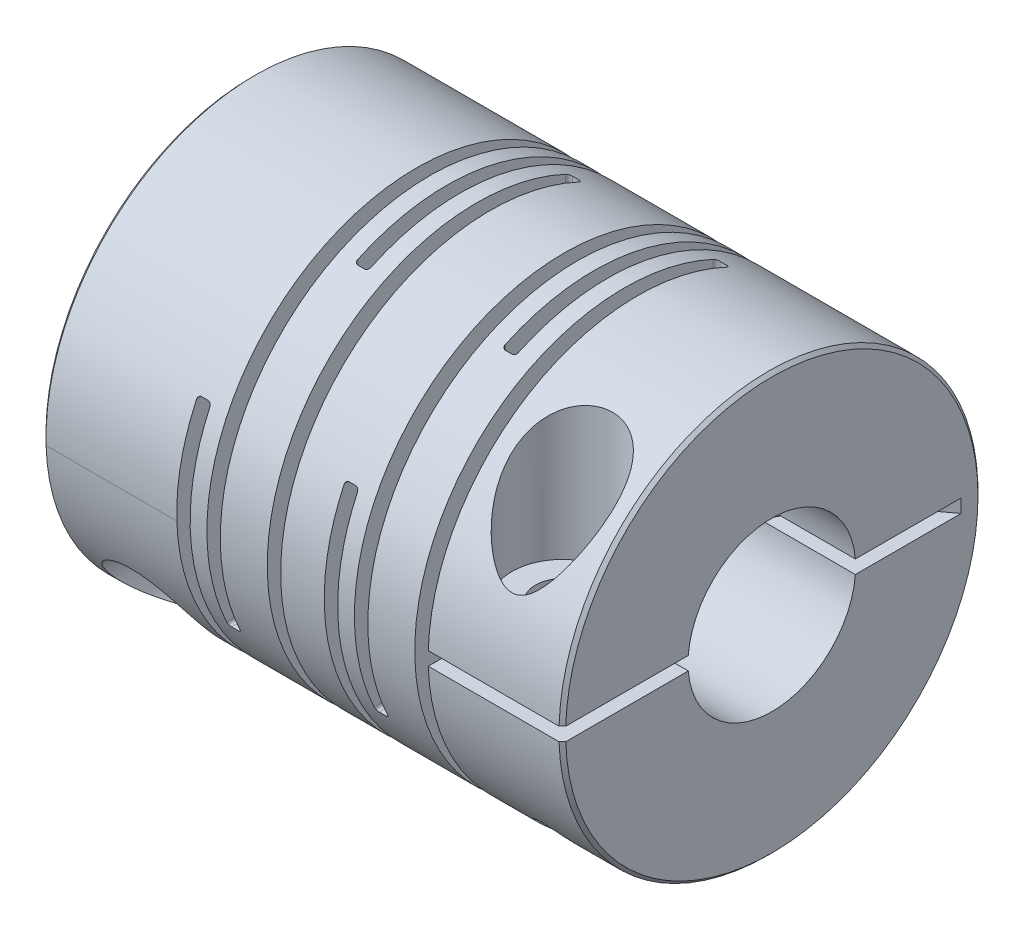
from build123d import *

# Parameters (mm, degrees)
SKETCH1_W                          = 31
SKETCH1_H                          = 12.5
CUT_EXTRUDE1_DEPTH                 = 42.740268327
CUT_EXTRUDE2_DEPTH                 = 42.740268491
CHAMFER1_SIZE                      = 0.2
CUT_EXTRUDE3_DEPTH                 = 0.4
CUT_EXTRUDE4_DEPTH                 = 0.4
SOCKET_HEAD_CAP_SCREW1_D           = 3.2
SOCKET_HEAD_CAP_SCREW1_DEPTH       = 12.1
SOCKET_HEAD_CAP_SCREW1_CBORE_D     = 6
SOCKET_HEAD_CAP_SCREW1_CBORE_DEPTH = 9.5
TAP1_D                             = 2.459
SOCKET_HEAD_CAP_SCREW2_D           = 3.2
SOCKET_HEAD_CAP_SCREW2_DEPTH       = 12.1
SOCKET_HEAD_CAP_SCREW2_CBORE_D     = 6
SOCKET_HEAD_CAP_SCREW2_CBORE_DEPTH = 9.5
TAP2_D                             = 2.459
SKETCH16_W                         = 15
SKETCH16_H                         = 5
SKETCH17_R                         = 4
CUT_EXTRUDE5_DEPTH                 = 8
CUT_EXTRUDE6_START                 = -8
SKETCH18_R                         = 5
CUT_EXTRUDE6_DEPTH                 = 8


with BuildPart() as part:
    # Sketch1 → Revolve1 (revolve)
    with BuildSketch(Plane.XY, mode=Mode.PRIVATE) as revolve1_sk:
        with Locations((15.5, 6.25)):
            Rectangle(SKETCH1_W, SKETCH1_H)
    revolve(revolve1_sk.sketch.rotate(Axis((0, 0, 0), (1, 0, 0)), 90), axis=Axis((0, 0, 0), (1, 0, 0)))

    # Sketch2 → Cut-Extrude1 (cut, through all)
    with BuildSketch(Plane.XY.offset(12.5)):
        with BuildLine():
            Line((19.4, 12.5), (19.4, -5.3))
            ThreePointArc((19.4, -5.3), (19.341421356, -5.441421356), (19.2, -5.5))
            Line((19.2, -5.5), (18.8, -5.5))
            ThreePointArc((18.8, -5.5), (18.658578644, -5.441421356), (18.6, -5.3))
            Line((18.6, -5.3), (18.6, 12.5))
            Line((18.6, 12.5), (19.4, 12.5))
        make_face()
        with BuildLine():
            Line((17.6, 5.3), (17.6, -12.5))
            Line((17.6, -12.5), (16.8, -12.5))
            Line((16.8, -12.5), (16.8, 5.3))
            ThreePointArc((16.8, 5.3), (16.858578644, 5.441421356), (17, 5.5))
            Line((17, 5.5), (17.4, 5.5))
            ThreePointArc((17.4, 5.5), (17.541421356, 5.441421356), (17.6, 5.3))
        make_face()
        with BuildLine():
            Line((10.6, 12.5), (10.6, -5.3))
            ThreePointArc((10.6, -5.3), (10.541421356, -5.441421356), (10.4, -5.5))
            Line((10.4, -5.5), (10, -5.5))
            ThreePointArc((10, -5.5), (9.858578644, -5.441421356), (9.8, -5.3))
            Line((9.8, -5.3), (9.8, 12.5))
            Line((9.8, 12.5), (10.6, 12.5))
        make_face()
        with BuildLine():
            Line((8.8, 5.3), (8.8, -12.5))
            Line((8.8, -12.5), (8, -12.5))
            Line((8, -12.5), (8, 5.3))
            ThreePointArc((8, 5.3), (8.058578644, 5.441421356), (8.2, 5.5))
            Line((8.2, 5.5), (8.6, 5.5))
            ThreePointArc((8.6, 5.5), (8.741421356, 5.441421356), (8.8, 5.3))
        make_face()
    extrude(amount=-CUT_EXTRUDE1_DEPTH, mode=Mode.SUBTRACT)

    # Sketch3 → Cut-Extrude2 (cut, through all)
    with BuildSketch(Plane(origin=(0, 12.5, 0), x_dir=(1, 0, 0), z_dir=(0, 1, 0))):
        with BuildLine():
            Line((21.2, 12.5), (21.2, -5.3))
            ThreePointArc((21.2, -5.3), (21.141421356, -5.441421356), (21, -5.5))
            Line((21, -5.5), (20.6, -5.5))
            ThreePointArc((20.6, -5.5), (20.458578644, -5.441421356), (20.4, -5.3))
            Line((20.4, -5.3), (20.4, 12.5))
            Line((20.4, 12.5), (21.2, 12.5))
        make_face()
        with BuildLine():
            Line((23, 5.3), (23, -12.5))
            Line((23, -12.5), (22.2, -12.5))
            Line((22.2, -12.5), (22.2, 5.3))
            ThreePointArc((22.2, 5.3), (22.258578644, 5.441421356), (22.4, 5.5))
            Line((22.4, 5.5), (22.8, 5.5))
            ThreePointArc((22.8, 5.5), (22.941421356, 5.441421356), (23, 5.3))
        make_face()
        with BuildLine():
            Line((12.4, 12.5), (12.4, -5.3))
            ThreePointArc((12.4, -5.3), (12.341421356, -5.441421356), (12.2, -5.5))
            Line((12.2, -5.5), (11.8, -5.5))
            ThreePointArc((11.8, -5.5), (11.658578644, -5.441421356), (11.6, -5.3))
            Line((11.6, -5.3), (11.6, 12.5))
            Line((11.6, 12.5), (12.4, 12.5))
        make_face()
        with BuildLine():
            Line((14.2, 5.3), (14.2, -12.5))
            Line((14.2, -12.5), (13.4, -12.5))
            Line((13.4, -12.5), (13.4, 5.3))
            ThreePointArc((13.4, 5.3), (13.458578644, 5.441421356), (13.6, 5.5))
            Line((13.6, 5.5), (14, 5.5))
            ThreePointArc((14, 5.5), (14.141421356, 5.441421356), (14.2, 5.3))
        make_face()
    extrude(amount=-CUT_EXTRUDE2_DEPTH, mode=Mode.SUBTRACT)

    # Chamfer1
    chamfer1_edges = [part.edges().sort_by_distance(p)[0] for p in [
        (31, 0, -12.5),
        (0, 0, -12.5),
    ]]
    chamfer(chamfer1_edges, length=CHAMFER1_SIZE)

    # Sketch4 → Cut-Extrude3 (cut, symmetric)
    with BuildSketch(Plane.XY):
        with BuildLine():
            Line((8.4, -12.5), (-11.6, -12.5))
            Line((-11.6, -12.5), (-11.6, 15))
            ThreePointArc((-11.6, 15), (2.542135624, 9.142135624), (8.4, -5))
            Line((8.4, -5), (8.4, -12.5))
        make_face()
    extrude(amount=CUT_EXTRUDE3_DEPTH, both=True, mode=Mode.SUBTRACT)

    # Sketch5 → Cut-Extrude4 (cut, symmetric)
    with BuildSketch(Plane(origin=(0, 0, 0), x_dir=(1, 0, 0), z_dir=(0, 1, 0))):
        with BuildLine():
            Line((22.6, -12.5), (42.6, -12.5))
            Line((42.6, -12.5), (42.6, 15))
            ThreePointArc((42.6, 15), (28.457864376, 9.142135624), (22.6, -5))
            Line((22.6, -5), (22.6, -12.5))
        make_face()
    extrude(amount=CUT_EXTRUDE4_DEPTH, both=True, mode=Mode.SUBTRACT)

    # Socket Head Cap Screw1
    with Locations(Plane.XY.offset(12.5)):
        with Locations((4, -8.5)):
            CounterBoreHole(SOCKET_HEAD_CAP_SCREW1_D / 2, SOCKET_HEAD_CAP_SCREW1_CBORE_D / 2, SOCKET_HEAD_CAP_SCREW1_CBORE_DEPTH, depth=SOCKET_HEAD_CAP_SCREW1_DEPTH)

    # Tap1 (through all)
    with Locations(Plane.XY.offset(-0.4)):
        with Locations((4, -8.5)):
            Hole(TAP1_D / 2)

    # Socket Head Cap Screw2
    with Locations(Plane(origin=(0, 12.5, 0), x_dir=(1, 0, 0), z_dir=(0, 1, 0))):
        with Locations((27, -8.5)):
            CounterBoreHole(SOCKET_HEAD_CAP_SCREW2_D / 2, SOCKET_HEAD_CAP_SCREW2_CBORE_D / 2, SOCKET_HEAD_CAP_SCREW2_CBORE_DEPTH, depth=SOCKET_HEAD_CAP_SCREW2_DEPTH)

    # Tap2 (through all)
    with Locations(Plane(origin=(0, -0.4, 0), x_dir=(1, 0, 0), z_dir=(0, 1, 0))):
        with Locations((27, -8.5)):
            Hole(TAP2_D / 2)

    # Sketch16 → Cut-Revolve2 (revolve, cut)
    with BuildSketch(Plane.XY, mode=Mode.PRIVATE) as cut_revolve2_sk:
        with Locations((15.5, 2.503252893)):
            Rectangle(SKETCH16_W, SKETCH16_H)
    revolve(cut_revolve2_sk.sketch.rotate(Axis((0, 0.003252893, 0), (1, 0, 0)), 90), axis=Axis((0, 0.003252893, 0), (1, 0, 0)), mode=Mode.SUBTRACT)

    # Sketch17 → Cut-Extrude5 (cut)
    with BuildSketch(Plane(origin=(0, 0, 0), x_dir=(0, 0, -1), z_dir=(1, 0, 0))):
        Circle(SKETCH17_R)
    extrude(amount=CUT_EXTRUDE5_DEPTH, mode=Mode.SUBTRACT)

    # Sketch18 → Cut-Extrude6 (cut)
    with BuildSketch(Plane(origin=(31, 0, 0), x_dir=(0, 0, -1), z_dir=(1, 0, 0)).offset(CUT_EXTRUDE6_START)):
        Circle(SKETCH18_R)
    extrude(amount=CUT_EXTRUDE6_DEPTH, mode=Mode.SUBTRACT)


solid = part.part
